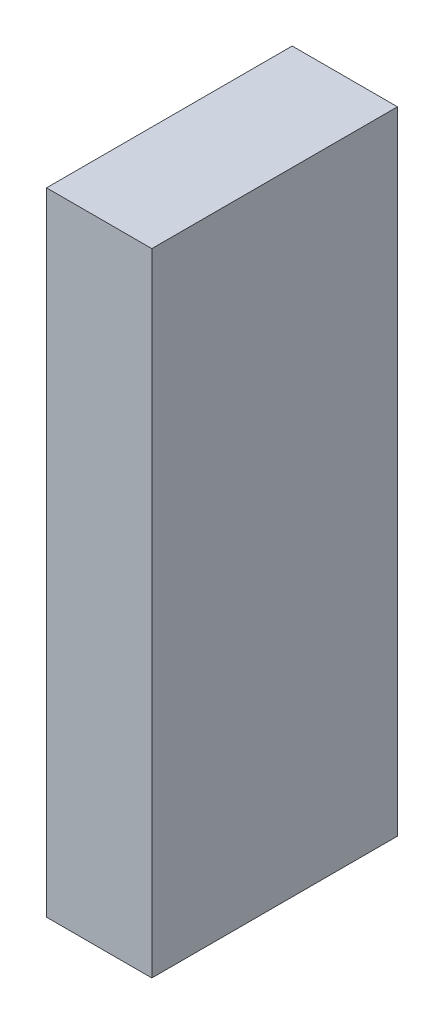
from build123d import *

# Parameters (mm, degrees)
SKETCH1_W           = 38.1
SKETCH1_H           = 88.9
BOSS_EXTRUDE1_DEPTH = 228.6


with BuildPart() as part:
    # Sketch1 → Boss-Extrude1 (new body)
    with BuildSketch(Plane(origin=(0, 0, 0), x_dir=(1, 0, 0), z_dir=(0, 1, 0))):
        with Locations((19.05, 44.45)):
            Rectangle(SKETCH1_W, SKETCH1_H)
    extrude(amount=BOSS_EXTRUDE1_DEPTH)


solid = part.part
